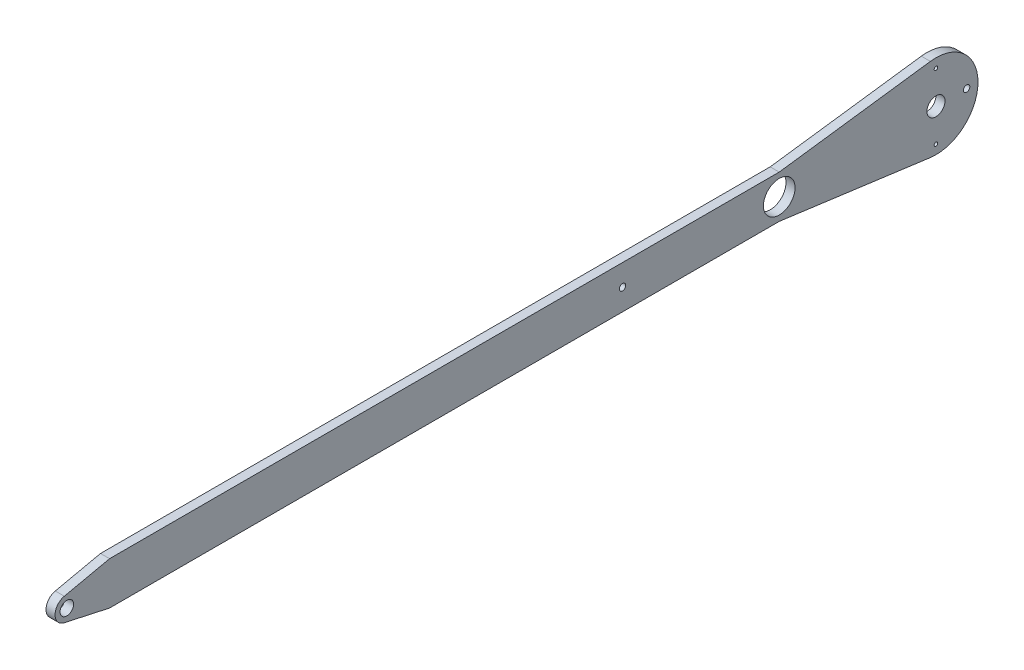
from build123d import *

# Parameters (mm, degrees)
SKETCH1_R             = 6.35
SKETCH1_R_2           = 11.1125
SKETCH1_R_3           = 4.7625
BOSS_EXTRUDE1_DEPTH   = 3.175
M3X0_5_TAPPED_HOLE1_D = 2.5
M4_CLEARANCE_HOLE1_D  = 4.5


with BuildPart() as part:
    # Sketch1 → Boss-Extrude1 (new, symmetric)
    with BuildSketch(Plane(origin=(0, 0, 0), x_dir=(0, 0, -1), z_dir=(1, 0, 0))):
        with BuildLine():
            Line((-470, 15), (-501.760727799, 8.072716015))
            ThreePointArc((-501.760727799, 8.072716015), (-508.2625, 0), (-501.760727799, -8.072716015))
            Line((-501.760727799, -8.072716015), (-470, -15))
            Line((-470, -15), (0, -15))
            Line((0, -15), (106.075609583, -29.237803609))
            ThreePointArc((106.075609583, -29.237803609), (139.5, 0), (106.075609583, 29.237803609))
            Line((106.075609583, 29.237803609), (0, 15))
            Line((0, 15), (-470, 15))
        make_face()
        with Locations((110, 0)):
            Circle(SKETCH1_R, mode=Mode.SUBTRACT)
        Circle(SKETCH1_R_2, mode=Mode.SUBTRACT)
        with Locations((-500, 0)):
            Circle(SKETCH1_R_3, mode=Mode.SUBTRACT)
    extrude(amount=BOSS_EXTRUDE1_DEPTH, both=True)

    # M3x0.5 Tapped Hole1 (through all)
    with Locations(Plane(origin=(3.175, 0, 0), x_dir=(0, 0, -1), z_dir=(1, 0, 0))):
        with Locations((110, 23.015), (110, 0), (110, -23.015)):
            Hole(M3X0_5_TAPPED_HOLE1_D / 2)

    # M4 Clearance Hole1 (through all)
    with Locations(Plane(origin=(3.175, 0, 0), x_dir=(0, 0, -1), z_dir=(1, 0, 0))):
        with Locations((131.5, 0), (-110, 0)):
            Hole(M4_CLEARANCE_HOLE1_D / 2)


solid = part.part
